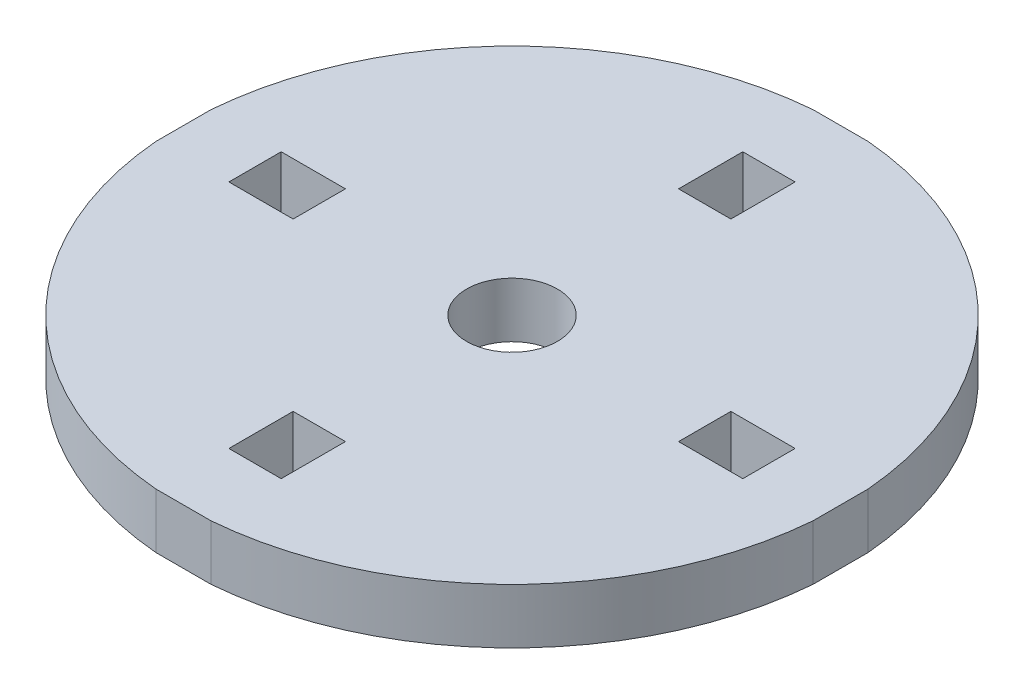
from build123d import *

# Parameters (mm, degrees)
SKETCH1_R           = 2.475
SKETCH1_W           = 2.85
SKETCH1_H           = 3.5
SKETCH1_W_2         = 3.5
SKETCH1_H_2         = 2.85
BOSS_EXTRUDE1_DEPTH = 3


with BuildPart() as part:
    # Sketch1 → Boss-Extrude1 (new body)
    with BuildSketch(Plane(origin=(0, 0, 0), x_dir=(1, 0, 0), z_dir=(0, 1, 0))):
        with BuildLine():
            Line((-1.5, -17.9), (1.5, -17.9))
            ThreePointArc((1.5, -17.9), (12.701574706, -12.701574706), (17.9, -1.5))
            Line((17.9, -1.5), (17.9, 1.5))
            ThreePointArc((17.9, 1.5), (12.701574706, 12.701574706), (1.5, 17.9))
            Line((1.5, 17.9), (-1.5, 17.9))
            ThreePointArc((-1.5, 17.9), (-12.701574706, 12.701574706), (-17.9, 1.5))
            Line((-17.9, 1.5), (-17.9, -1.5))
            ThreePointArc((-17.9, -1.5), (-12.701574706, -12.701574706), (-1.5, -17.9))
        make_face()
        with Locations(Location((0, 0, 0), (0, 0, 270))):
            Circle(SKETCH1_R, mode=Mode.SUBTRACT)
        with Locations((0, -12.25)):
            Rectangle(SKETCH1_W, SKETCH1_H, mode=Mode.SUBTRACT)
        with Locations((-12.25, 0)):
            Rectangle(SKETCH1_W_2, SKETCH1_H_2, mode=Mode.SUBTRACT)
        with Locations((0, 12.25)):
            Rectangle(SKETCH1_W, SKETCH1_H, mode=Mode.SUBTRACT)
        with Locations((12.25, 0)):
            Rectangle(SKETCH1_W_2, SKETCH1_H_2, mode=Mode.SUBTRACT)
    extrude(amount=BOSS_EXTRUDE1_DEPTH)


solid = part.part
